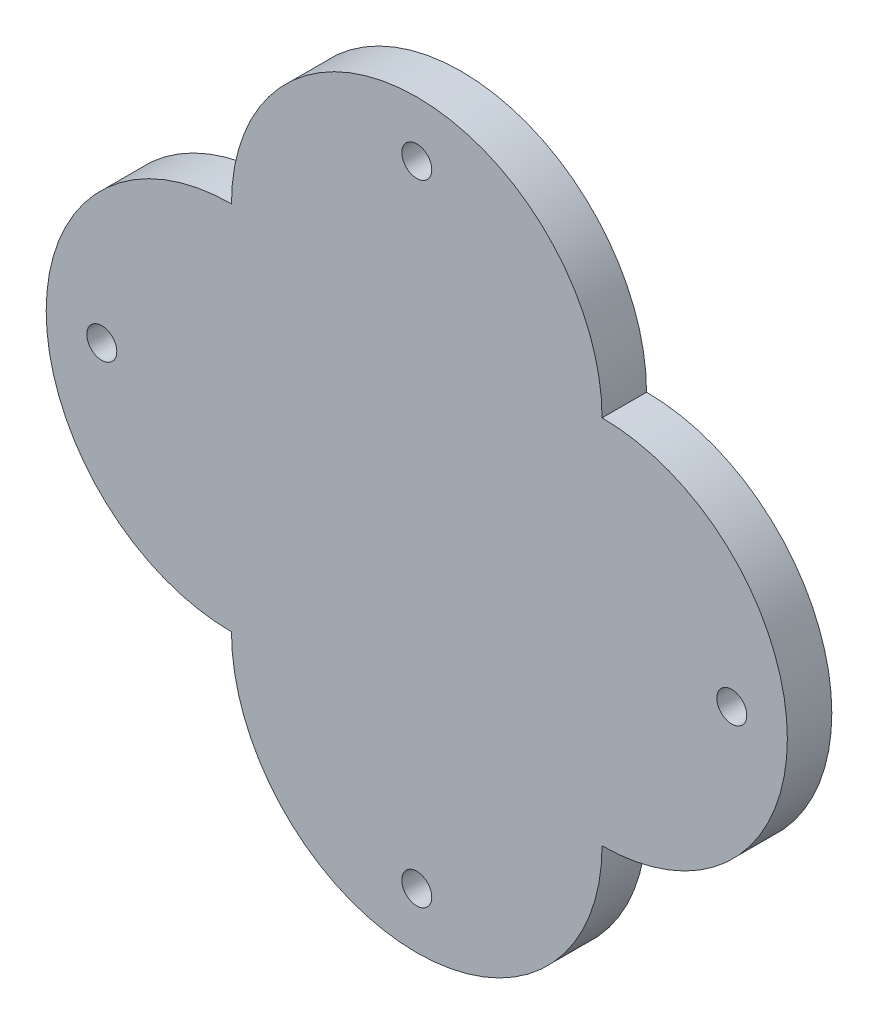
from build123d import *

# Parameters (mm, degrees)
IZIM1_R                     = 9.5
Y_KSEKLIK_EKSTR_ZYON1_DEPTH = 12
Y_KSEKLIK_EKSTR_ZYON2_START = -6
IZIM2_R                     = 9.5
IZIM2_R_2                   = 4.05
Y_KSEKLIK_EKSTR_ZYON2_DEPTH = 6


with BuildPart() as part:
    # Çizim1 → Yükseklik-Ekstrüzyon1 (new body)
    with BuildSketch(Plane.XY):
        with BuildLine():
            ThreePointArc((55.555555556, 45.593869732), (5.555555556, 95.593869732), (-44.444444444, 45.593869732))
            ThreePointArc((-44.444444444, 45.593869732), (-94.444444444, -4.406130268), (-44.444444444, -54.406130268))
            ThreePointArc((-44.444444444, -54.406130268), (5.555555556, -104.406130268), (55.555555556, -54.406130268))
            ThreePointArc((55.555555556, -54.406130268), (105.555555556, -4.406130268), (55.555555556, 45.593869732))
        make_face()
        with Locations((-79.444444444, -4.406130268)):
            Circle(IZIM1_R, mode=Mode.SUBTRACT)
        with Locations((5.555555556, 80.593869732)):
            Circle(IZIM1_R, mode=Mode.SUBTRACT)
        with Locations((90.555555556, -4.406130268)):
            Circle(IZIM1_R, mode=Mode.SUBTRACT)
        with Locations((5.555555556, -89.406130268)):
            Circle(IZIM1_R, mode=Mode.SUBTRACT)
    extrude(amount=Y_KSEKLIK_EKSTR_ZYON1_DEPTH)

    # Çizim2 → Yükseklik-Ekstrüzyon2 (add)
    # profile 1 of 4: a face of its own
    with BuildSketch(Plane.XY.offset(12).offset(Y_KSEKLIK_EKSTR_ZYON2_START)):
        with Locations((5.555555556, 80.593869732)):
            Circle(IZIM2_R)
        with Locations((5.555555556, 80.593869732)):
            Circle(IZIM2_R_2, mode=Mode.SUBTRACT)
    # profile 2 of 4: a face of its own
    with BuildSketch(Plane.XY.offset(12).offset(Y_KSEKLIK_EKSTR_ZYON2_START)):
        with Locations((90.555555556, -4.406130268)):
            Circle(IZIM2_R)
        with Locations((90.555555556, -4.406130268)):
            Circle(IZIM2_R_2, mode=Mode.SUBTRACT)
    # profile 3 of 4: a face of its own
    with BuildSketch(Plane.XY.offset(12).offset(Y_KSEKLIK_EKSTR_ZYON2_START)):
        with Locations((5.555555556, -89.406130268)):
            Circle(IZIM2_R)
        with Locations((5.555555556, -89.406130268)):
            Circle(IZIM2_R_2, mode=Mode.SUBTRACT)
    # profile 4 of 4: a face of its own
    with BuildSketch(Plane.XY.offset(12).offset(Y_KSEKLIK_EKSTR_ZYON2_START)):
        with Locations((-79.444444444, -4.406130268)):
            Circle(IZIM2_R)
        with Locations((-79.444444444, -4.406130268)):
            Circle(IZIM2_R_2, mode=Mode.SUBTRACT)
    extrude(amount=Y_KSEKLIK_EKSTR_ZYON2_DEPTH)


solid = part.part
